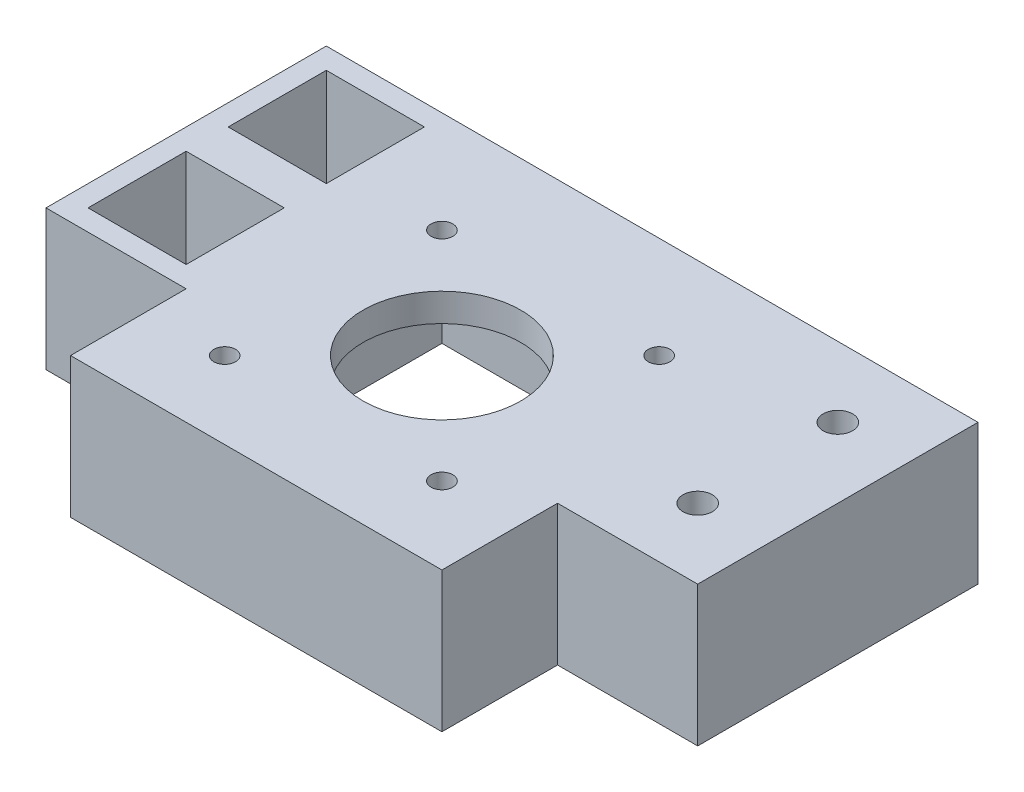
from build123d import *
from build123d.topology import SkipClean

# Parameters (mm, degrees)
SKETCH2_R            = 11.25
SKETCH2_R_2          = 1.55
SKETCH2_R_3          = 2.1
BOSS_EXTRUDE1_DEPTH  = 4
SKETCH3_W            = 57.5
SKETCH3_H            = 14
SKETCH3_W_2          = 43
SKETCH3_H_2          = 43
BOSS_EXTRUDE2_DEPTH  = 10
SKETCH4_W            = 63.5
SKETCH4_H            = 20
SKETCH4_R            = 2.1
BOSS_EXTRUDE3_DEPTH  = 4
BOSS_EXTRUDE4_DEPTH  = 10
SKETCH6_W            = 20
SKETCH6_H            = 40
CUT_EXTRUDE1_DEPTH   = 31
SKETCH7_W            = 3
SKETCH7_H            = 40
BOSS_EXTRUDE5_DEPTH  = 10
SKETCH8_W            = 20
SKETCH8_H            = 40
CUT_EXTRUDE2_DEPTH   = 31
SKETCH9_W            = 3
SKETCH9_H            = 34
BOSS_EXTRUDE6_DEPTH  = 10
SKETCH10_R           = 2.1
CUT_EXTRUDE3_DEPTH   = 31
BOSS_EXTRUDE7_DEPTH  = 4
SKETCH12_W           = 0.5
SKETCH12_H           = 14
CUT_EXTRUDE4_DEPTH   = 31
SKETCH13_W           = 3
SKETCH13_H           = 34
BOSS_EXTRUDE8_DEPTH  = 10
SKETCH15_R           = 2.1
BOSS_EXTRUDE9_DEPTH  = 4
SKETCH16_W           = 14
SKETCH16_H           = 34
SKETCH16_H_2         = 3
BOSS_EXTRUDE10_DEPTH = 10
SKETCH17_W           = 53
SKETCH17_H           = 3.5
BOSS_EXTRUDE11_DEPTH = 14
SKETCH19_W           = 43
SKETCH19_H           = 43
SKETCH19_W_2         = 14
SKETCH19_H_2         = 14
BOSS_EXTRUDE12_DEPTH = 6
SKETCH20_W           = 14
SKETCH20_H           = 14
CUT_EXTRUDE5_DEPTH   = 6
SKETCH21_W           = 14
SKETCH21_H           = 14
SKETCH21_R           = 2.1
SKETCH21_R_2         = 2.6
BOSS_EXTRUDE13_DEPTH = 4


with BuildPart() as part:
    # Sketch2 → Boss-Extrude1 (new body)
    with BuildSketch(Plane(origin=(0, 0, 0), x_dir=(1, 0, 0), z_dir=(0, 1, 0))):
        Polygon((-26.5, 26.5), (26.5, 26.5), (26.5, 10), (90, 10), (90, -10), (26.5, -10), (26.5, -26.5), (-26.5, -26.5), align=None)
        with Locations(Location((0, 0, 0), (0, 0, 270))):
            Circle(SKETCH2_R, mode=Mode.SUBTRACT)
        with Locations(Location((-15.5, 15.5, 0), (0, 0, 270))):
            Circle(SKETCH2_R_2, mode=Mode.SUBTRACT)
        with Locations(Location((15.5, 15.5, 0), (0, 0, 270))):
            Circle(SKETCH2_R_2, mode=Mode.SUBTRACT)
        with Locations(Location((15.5, -15.5, 0), (0, 0, 270))):
            Circle(SKETCH2_R_2, mode=Mode.SUBTRACT)
        with Locations(Location((-15.5, -15.5, 0), (0, 0, 270))):
            Circle(SKETCH2_R_2, mode=Mode.SUBTRACT)
        with Locations(Location((40, 0, 0), (0, 0, 270))):
            Circle(SKETCH2_R_3, mode=Mode.SUBTRACT)
        with Locations(Location((60, 0, 0), (0, 0, 270))):
            Circle(SKETCH2_R_3, mode=Mode.SUBTRACT)
        with Locations(Location((80, 0, 0), (0, 0, 270))):
            Circle(SKETCH2_R_3, mode=Mode.SUBTRACT)
    extrude(amount=BOSS_EXTRUDE1_DEPTH)

    # Sketch3 → Boss-Extrude2 (add)
    with BuildSketch(Plane(origin=(0, 0, 0), x_dir=(1, 0, 0), z_dir=(0, 1, 0))):
        Polygon((-26.5, -26.5), (26.5, -26.5), (26.5, -10), (90, -10), (90, 10), (26.5, 10), (26.5, 26.5), (-26.5, 26.5), align=None)
        with Locations((58.25, 0)):
            Rectangle(SKETCH3_W, SKETCH3_H, mode=Mode.SUBTRACT)
        Rectangle(SKETCH3_W_2, SKETCH3_H_2, mode=Mode.SUBTRACT)
    extrude(amount=-BOSS_EXTRUDE2_DEPTH)

    # Sketch4 → Boss-Extrude3 (add)
    with BuildSketch(Plane(origin=(0, 4, 0), x_dir=(1, 0, 0), z_dir=(0, 1, 0))):
        with Locations((58.25, 20)):
            Rectangle(SKETCH4_W, SKETCH4_H)
        with Locations(Location((80, 20, 0), (0, 0, 270))):
            Circle(SKETCH4_R, mode=Mode.SUBTRACT)
        with Locations(Location((60, 20, 0), (0, 0, 270))):
            Circle(SKETCH4_R, mode=Mode.SUBTRACT)
        with Locations(Location((40, 20, 0), (0, 0, 270))):
            Circle(SKETCH4_R, mode=Mode.SUBTRACT)
    extrude(amount=-BOSS_EXTRUDE3_DEPTH)

    # Sketch5 → Boss-Extrude4 (add)
    with BuildSketch(Plane.XZ):
        Polygon((90, -10), (26.5, -10), (26.5, -26.5), (26.5, -30), (90, -30), align=None)
        Polygon((87, -13), (29.5, -13), (29.5, -26.5), (29.5, -27), (87, -27), align=None, mode=Mode.SUBTRACT)
    extrude(amount=BOSS_EXTRUDE4_DEPTH)

    # Sketch6 → Cut-Extrude1 (cut)
    with BuildSketch(Plane.XZ.offset(10)):
        with Locations((80, -10)):
            Rectangle(SKETCH6_W, SKETCH6_H)
    extrude(amount=-CUT_EXTRUDE1_DEPTH, mode=Mode.SUBTRACT)

    # Sketch7 → Boss-Extrude5 (add)
    with BuildSketch(Plane.XZ):
        with Locations((68.5, -10)):
            Rectangle(SKETCH7_W, SKETCH7_H)
    extrude(amount=BOSS_EXTRUDE5_DEPTH)

    # Sketch8 → Cut-Extrude2 (cut)
    with BuildSketch(Plane.XZ.offset(10)):
        with Locations((60, -10)):
            Rectangle(SKETCH8_W, SKETCH8_H)
    extrude(amount=-CUT_EXTRUDE2_DEPTH, mode=Mode.SUBTRACT)

    # Sketch9 → Boss-Extrude6 (add)
    with BuildSketch(Plane.XZ):
        with Locations((48.5, -10)):
            Rectangle(SKETCH9_W, SKETCH9_H)
    extrude(amount=BOSS_EXTRUDE6_DEPTH)

    # Sketch10 → Cut-Extrude3 (cut)
    with BuildSketch(Plane.XZ.offset(10)):
        with Locations((36.5, -20)):
            Circle(SKETCH10_R)
        with Locations((36.5, 0)):
            Circle(SKETCH10_R)
    extrude(amount=-CUT_EXTRUDE3_DEPTH, mode=Mode.SUBTRACT)

    # Sketch11 → Boss-Extrude7 (add)
    with SkipClean():  # the faces are left unmerged after this step: merging them gives an invalid solid
        with BuildSketch(Plane.XZ):
            with BuildLine():
                ThreePointArc((38.25, -18.839181323), (38.6, -20), (38.25, -21.160818677))
                ThreePointArc((38.25, -21.160818677), (42.1, -20), (38.25, -18.839181323))
            make_face()
            with BuildLine():
                ThreePointArc((38.25, -1.160818677), (42.1, 0), (38.25, 1.160818677))
                ThreePointArc((38.25, 1.160818677), (38.6, 0), (38.25, -1.160818677))
            make_face()
        extrude(amount=-BOSS_EXTRUDE7_DEPTH)

    # Sketch12 → Cut-Extrude4 (cut)
    with SkipClean():  # the faces are left unmerged after this step: merging them gives an invalid solid
        with BuildSketch(Plane.XZ.offset(10)):
            Polygon((50, -30), (46.5, -30), (46.5, -36.524115579), (58.005951577, -36.524115579), (58.005951577, 17.068151821), (46.5, 17.068151821), (46.5, 10), (50, 10), align=None)
            Polygon((47, -27), (46.5, -27), (46.5, -30), (50, -30), (50, 10), (46.5, 10), (46.5, 7), (47, 7), (47, -7), (46.5, -7), (46.5, -13), (47, -13), align=None)
            Polygon((46.5, -13), (46.5, -20), (46.5, -27), (47, -27), (47, -13), align=None)
            with Locations((46.75, 0)):
                Rectangle(SKETCH12_W, SKETCH12_H)
        extrude(amount=-CUT_EXTRUDE4_DEPTH, mode=Mode.SUBTRACT)

    # Sketch13 → Boss-Extrude8 (add)
    with SkipClean():  # the faces are left unmerged after this step: merging them gives an invalid solid
        with BuildSketch(Plane.XZ):
            with Locations((45, -10)):
                Rectangle(SKETCH13_W, SKETCH13_H)
        extrude(amount=BOSS_EXTRUDE8_DEPTH)

    # Sketch15 → Boss-Extrude9 (add)
    with SkipClean():  # the faces are left unmerged after this step: merging them gives an invalid solid
        with BuildSketch(Plane(origin=(0, 4, 0), x_dir=(1, 0, 0), z_dir=(0, 1, 0))):
            Polygon((-26.5, 30), (-46.5, 30), (-46.5, -10), (-26.5, -10), (-26.5, 26.5), align=None)
            with Locations(Location((-36.5, 0, 0), (0, 0, 270))):
                Circle(SKETCH15_R, mode=Mode.SUBTRACT)
            with Locations(Location((-36.5, 20, 0), (0, 0, 270))):
                Circle(SKETCH15_R, mode=Mode.SUBTRACT)
        extrude(amount=-BOSS_EXTRUDE9_DEPTH)

    # Sketch16 → Boss-Extrude10 (add)
    # profile 1 of 3: a face of its own
    with SkipClean():  # the faces are left unmerged after this step: merging them gives an invalid solid
        with BuildSketch(Plane.XZ):
            Polygon((-46.5, 10), (-46.5, -30), (-26.5, -30), (-26.5, -26.5), (-26.5, 10), align=None)
            with Locations((-36.5, -10)):
                Rectangle(SKETCH16_W, SKETCH16_H, mode=Mode.SUBTRACT)
        # profile 2 of 3: a face of its own
        with BuildSketch(Plane.XZ):
            with Locations((-36.5, -11.5)):
                Rectangle(SKETCH16_W, SKETCH16_H_2)
        # profile 3 of 3: a face of its own
        with BuildSketch(Plane.XZ):
            with Locations((-36.5, -8.5)):
                Rectangle(SKETCH16_W, SKETCH16_H_2)
        extrude(amount=BOSS_EXTRUDE10_DEPTH)

    # Sketch17 → Boss-Extrude11 (add)
    with SkipClean():  # the faces are left unmerged after this step: merging them gives an invalid solid
        with BuildSketch(Plane.XZ.offset(10)):
            with Locations((0, -28.25)):
                Rectangle(SKETCH17_W, SKETCH17_H)
        extrude(amount=-BOSS_EXTRUDE11_DEPTH)

    # Sketch19 → Boss-Extrude12 (add)
    with SkipClean():  # the faces are left unmerged after this step: merging them gives an invalid solid
        with BuildSketch(Plane.XZ.offset(10)):
            Polygon((-46.5, 10), (-46.5, -30), (46.5, -30), (46.5, 10), (26.5, 10), (26.5, 26.5), (-26.5, 26.5), (-26.5, 10), align=None)
            Rectangle(SKETCH19_W, SKETCH19_H, mode=Mode.SUBTRACT)
            with Locations((36.5, -20)):
                Rectangle(SKETCH19_W_2, SKETCH19_H_2, mode=Mode.SUBTRACT)
            with Locations((36.5, 0)):
                Rectangle(SKETCH19_W_2, SKETCH19_H_2, mode=Mode.SUBTRACT)
            with Locations((-36.5, -20)):
                Rectangle(SKETCH19_W_2, SKETCH19_H_2, mode=Mode.SUBTRACT)
            with Locations((-36.5, 0)):
                Rectangle(SKETCH19_W_2, SKETCH19_H_2, mode=Mode.SUBTRACT)
        extrude(amount=BOSS_EXTRUDE12_DEPTH)

    # Sketch20 → Cut-Extrude5 (cut)
    with SkipClean():  # the faces are left unmerged after this step: merging them gives an invalid solid
        with BuildSketch(Plane.XZ):
            with Locations((-36.5, -20)):
                Rectangle(SKETCH20_W, SKETCH20_H)
            with Locations((-36.5, 0)):
                Rectangle(SKETCH20_W, SKETCH20_H)
        extrude(amount=-CUT_EXTRUDE5_DEPTH, mode=Mode.SUBTRACT)

    # Sketch21 → Boss-Extrude13 (add)
    # profile 1 of 2: a face of its own
    with SkipClean():  # the faces are left unmerged after this step: merging them gives an invalid solid
        with BuildSketch(Plane.XZ.offset(16)):
            with Locations((-36.5, -20)):
                Rectangle(SKETCH21_W, SKETCH21_H)
            with Locations(Location((-36.5, -20, 0), (0, 0, 270))):
                Circle(SKETCH21_R, mode=Mode.SUBTRACT)
        # profile 2 of 2: a face of its own
        with BuildSketch(Plane.XZ.offset(16)):
            with Locations((-36.5, 0)):
                Rectangle(SKETCH21_W, SKETCH21_H)
            with Locations(Location((-36.5, 0, 0), (0, 0, 270))):
                Circle(SKETCH21_R_2, mode=Mode.SUBTRACT)
        extrude(amount=-BOSS_EXTRUDE13_DEPTH)


solid = part.part
